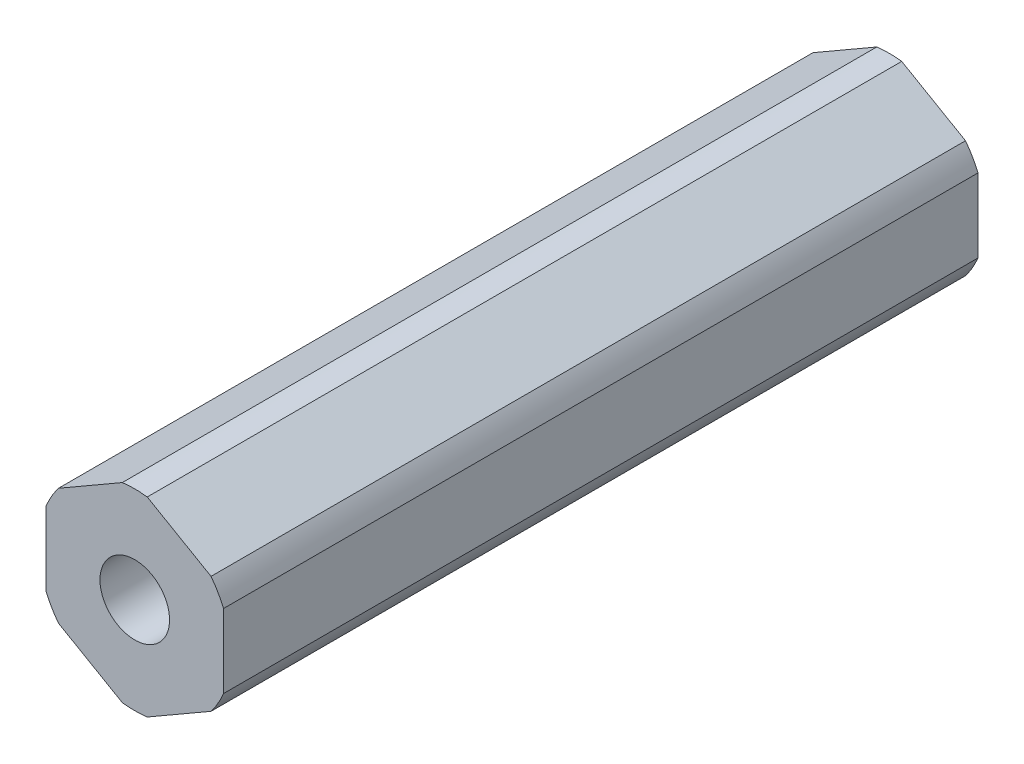
from build123d import *

# Parameters (mm, degrees)
BOSS_EXTRUDE1_DEPTH     = 53.975
CUT_EXTRUDE1_DEPTH      = 55.780368286
CUT_EXTRUDE1_DEPTH_BACK = 55.780368286
SKETCH2_R               = 2.4892


with BuildPart() as part:
    # Sketch1 → Boss-Extrude1 (new body)
    with BuildSketch(Plane.XY):
        with BuildLine():
            ThreePointArc((6.35, 2.634980936), (5.953924622, 3.437499983), (5.456960429, 4.181770846))
            Line((5.456960429, 4.181770846), (0.893039571, 6.816751782))
            ThreePointArc((0.893039571, 6.816751782), (0, 6.874999966), (-0.893039571, 6.816751782))
            Line((-0.893039571, 6.816751782), (-5.456960429, 4.181770846))
            ThreePointArc((-5.456960429, 4.181770846), (-5.953924622, 3.437499983), (-6.35, 2.634980936))
            Line((-6.35, 2.634980936), (-6.35, -2.634980936))
            ThreePointArc((-6.35, -2.634980936), (-5.953924622, -3.437499983), (-5.456960429, -4.181770846))
            Line((-5.456960429, -4.181770846), (-0.893039571, -6.816751782))
            ThreePointArc((-0.893039571, -6.816751782), (0, -6.874999966), (0.893039571, -6.816751782))
            Line((0.893039571, -6.816751782), (5.456960429, -4.181770846))
            ThreePointArc((5.456960429, -4.181770846), (5.953924622, -3.437499983), (6.35, -2.634980936))
            Line((6.35, -2.634980936), (6.35, 2.634980936))
        make_face()
    extrude(amount=BOSS_EXTRUDE1_DEPTH)

    # Sketch2 → Cut-Extrude1 (cut, two sides: drawn at the far end of the back side and taken through both)
    with BuildSketch(Plane(origin=(0, 0, 0), x_dir=(-1, 0, 0), z_dir=(0, 0, -1)).offset(-CUT_EXTRUDE1_DEPTH_BACK)):
        Circle(SKETCH2_R)
    extrude(amount=CUT_EXTRUDE1_DEPTH + CUT_EXTRUDE1_DEPTH_BACK, mode=Mode.SUBTRACT)


solid = part.part
